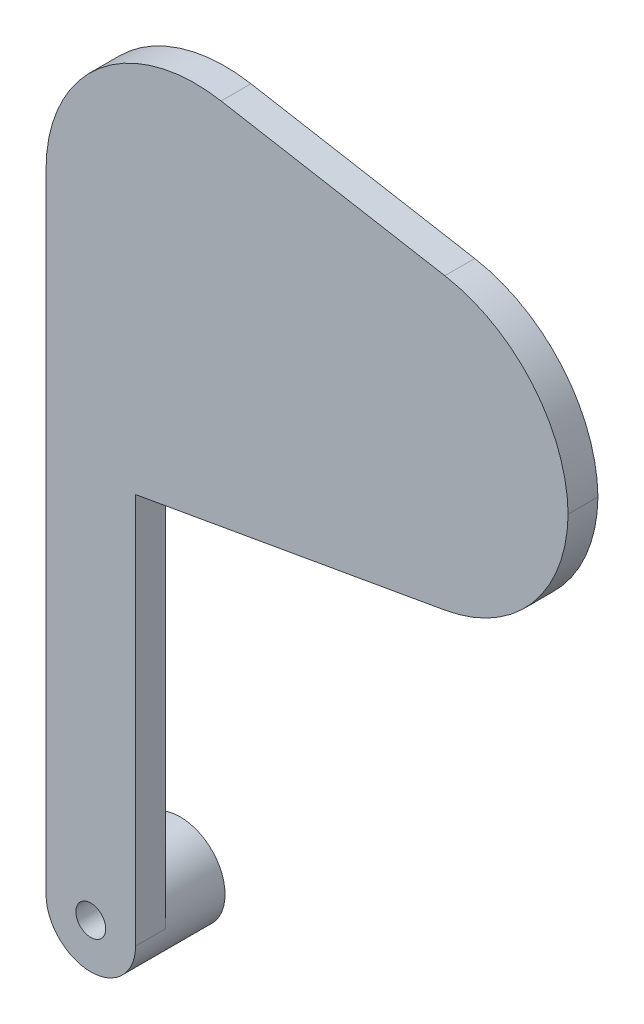
from build123d import *

# Parameters (mm, degrees)
BOSS_EXTRUDE1_DEPTH = 2
BOSS_EXTRUDE2_START = -6
SKETCH2_R           = 3
BOSS_EXTRUDE2_DEPTH = 6
SKETCH3_R           = 2.5
CUT_EXTRUDE1_DEPTH  = 4
SKETCH4_R           = 1
CUT_EXTRUDE2_DEPTH  = 2


with BuildPart() as part:
    # Sketch1 → Boss-Extrude1 (new body)
    with BuildSketch(Plane.XY):
        with BuildLine():
            Line((0, 42.082464074), (0, 0))
            ThreePointArc((0, 0), (3, -3), (6, 0))
            Line((6, 0), (6, 26.214927972))
            Line((6, 26.214927972), (26.736481777, 29.871329194))
            ThreePointArc((26.736481777, 29.871329194), (32.614961131, 33.237711964), (34.999006977, 39.578483044))
            ThreePointArc((34.999006977, 39.578483044), (32.614961131, 45.919254124), (26.736481777, 49.285636894))
            Line((26.736481777, 49.285636894), (11.736481777, 51.930541604))
            ThreePointArc((11.736481777, 51.930541604), (3.572123903, 49.742908505), (0, 42.082464074))
        make_face()
    extrude(amount=BOSS_EXTRUDE1_DEPTH)

    # Sketch2 → Boss-Extrude2 (add)
    with BuildSketch(Plane.XY.offset(2).offset(BOSS_EXTRUDE2_START)):
        with Locations((3, 0)):
            Circle(SKETCH2_R)
    extrude(amount=BOSS_EXTRUDE2_DEPTH)

    # Sketch3 → Cut-Extrude1 (cut)
    with BuildSketch(Plane(origin=(0, 0, -4), x_dir=(-1, 0, 0), z_dir=(0, 0, -1))):
        with Locations((-3, 0)):
            Circle(SKETCH3_R)
    extrude(amount=-CUT_EXTRUDE1_DEPTH, mode=Mode.SUBTRACT)

    # Sketch4 → Cut-Extrude2 (cut)
    with BuildSketch(Plane(origin=(0, 0, 0), x_dir=(-1, 0, 0), z_dir=(0, 0, -1))):
        with Locations((-3, 0)):
            Circle(SKETCH4_R)
    extrude(amount=-CUT_EXTRUDE2_DEPTH, mode=Mode.SUBTRACT)


solid = part.part
